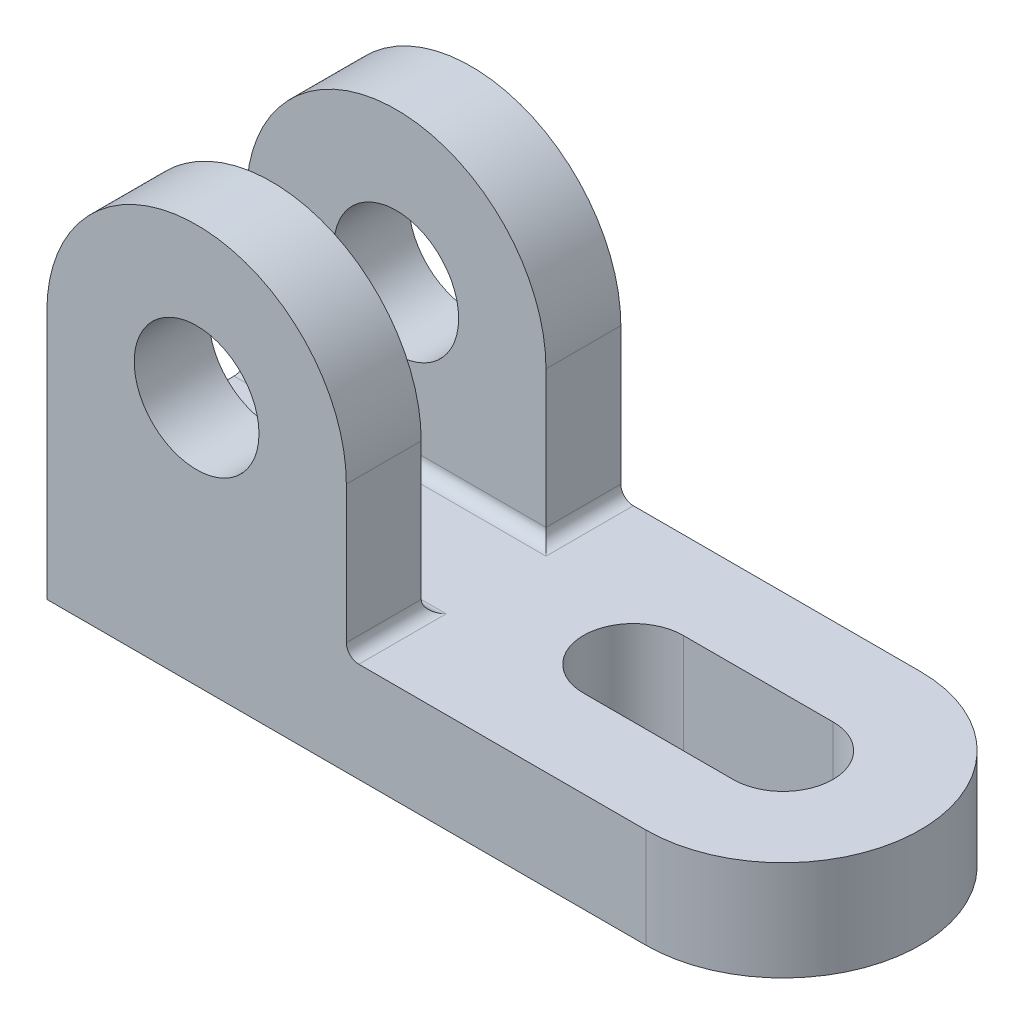
from build123d import *

# Parameters (mm, degrees)
BOSS_EXTRUDE1_DEPTH = 16
CUT_EXTRUDE1_DEPTH  = 16
SKETCH4_R           = 10
BOSS_EXTRUDE2_DEPTH = 12
FILLET1_R           = 2
FILLET2_R           = 2


with BuildPart() as part:
    # Sketch2 → Boss-Extrude1 (new body)
    with BuildSketch(Plane(origin=(0, 0, 0), x_dir=(1, 0, 0), z_dir=(0, 1, 0))):
        with BuildLine():
            Line((-59, 22), (-59, -22))
            Line((-59, -22), (37, -22))
            ThreePointArc((37, -22), (59, -3.2e-08), (37.000000064, 22))
            Line((37.000000064, 22), (-59, 22))
        make_face()
    extrude(amount=BOSS_EXTRUDE1_DEPTH)

    # Sketch3 → Cut-Extrude1 (cut)
    with BuildSketch(Plane(origin=(0, 16, 0), x_dir=(1, 0, 0), z_dir=(0, 1, 0))):
        with BuildLine():
            Line((37, -8), (13, -8))
            ThreePointArc((13, -8), (5, 0), (13, 8))
            Line((13, 8), (37, 8))
            ThreePointArc((37, 8), (45, 0), (37, -8))
        make_face()
    extrude(amount=-CUT_EXTRUDE1_DEPTH, mode=Mode.SUBTRACT)

    # Sketch4 → Boss-Extrude2 (add)
    with BuildSketch(Plane.XY.offset(22)):
        with BuildLine():
            Line((-59, 40), (-59, 16))
            Line((-59, 16), (-11, 16))
            Line((-11, 16), (-11, 40))
            ThreePointArc((-11, 40), (-35, 64), (-59, 40))
        make_face()
        with Locations((-35, 40)):
            Circle(SKETCH4_R, mode=Mode.SUBTRACT)
    boss_extrude2 = extrude(amount=-BOSS_EXTRUDE2_DEPTH)

    # Mirror1: Boss-Extrude2 across plane
    add(boss_extrude2.mirror(Plane.XY))

    # Fillet1
    fillet1_edges = [part.edges().sort_by_distance(p)[0] for p in [
        (-11, 16, 16),
        (-11, 16, -16),
    ]]
    fillet(fillet1_edges, radius=FILLET1_R)

    # Fillet2
    fillet2_edges = [part.edges().sort_by_distance(p)[0] for p in [
        (-34, 16, -10),
        (-34, 16, 10),
    ]]
    fillet(fillet2_edges, radius=FILLET2_R)


solid = part.part
